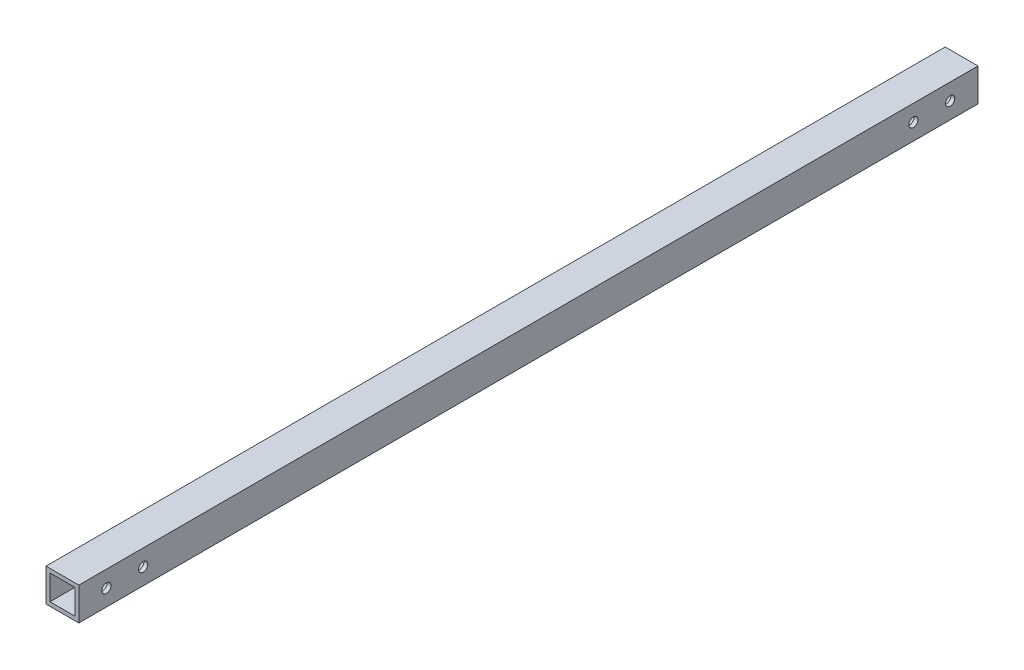
from build123d import *

# Parameters (mm, degrees)
SKETCH_1_W             = 25
SKETCH_1_H             = 25
SKETCH_1_W_2           = 19
SKETCH_1_H_2           = 19
EXTRUDE_1_DEPTH        = 684.5
HOLE_WIZARD_7_0_7_1_D  = 7
PATTERN_LINEAR_1_COUNT = 2
PATTERN_LINEAR_1_PITCH = 614.32


with BuildPart() as part:
    # 草图1 → 拉伸1 (new body)
    with BuildSketch(Plane.XY):
        with Locations((12.5, -12.5)):
            Rectangle(SKETCH_1_W, SKETCH_1_H)
        with Locations((12.5, -12.5)):
            Rectangle(SKETCH_1_W_2, SKETCH_1_H_2, mode=Mode.SUBTRACT)
    extrude(amount=EXTRUDE_1_DEPTH)

    # Ø7.0 (7) 直径孔1 (through all)
    with Locations(Plane(origin=(25, 0, 0), x_dir=(0, 0, -1), z_dir=(1, 0, 0))):
        with Locations((-635.5, -12.5), (-663.5, -12.5)):
            hole_wizard_7_0_7_1 = Hole(HOLE_WIZARD_7_0_7_1_D / 2)

    # 阵列(线性)1: Ø7.0 (7) 直径孔1 ×2
    with Locations(*[(0, 0, -i * PATTERN_LINEAR_1_PITCH) for i in range(1, PATTERN_LINEAR_1_COUNT)]):
        add(hole_wizard_7_0_7_1, mode=Mode.SUBTRACT)


solid = part.part
